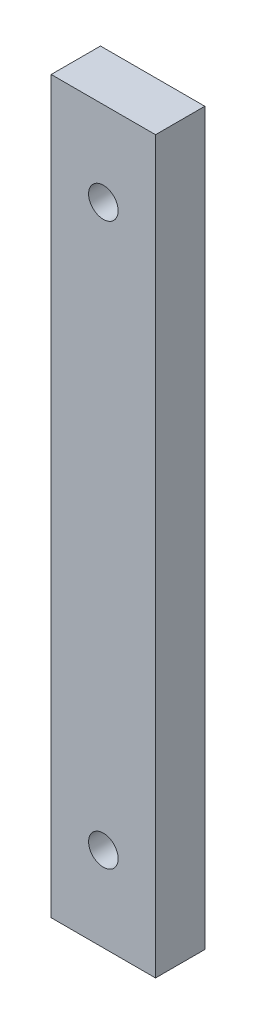
from build123d import *

# Parameters (mm, degrees)
SKETCH1_W           = 12.7
SKETCH1_H           = 88.9
SKETCH1_R           = 1.8
BOSS_EXTRUDE1_DEPTH = 6


with BuildPart() as part:
    # Sketch1 → Boss-Extrude1 (new body)
    with BuildSketch(Plane.XY):
        Rectangle(SKETCH1_W, SKETCH1_H)
        with Locations((0, 34.15)):
            Circle(SKETCH1_R, mode=Mode.SUBTRACT)
        with Locations((0, -34.15)):
            Circle(SKETCH1_R, mode=Mode.SUBTRACT)
    extrude(amount=BOSS_EXTRUDE1_DEPTH)


solid = part.part
